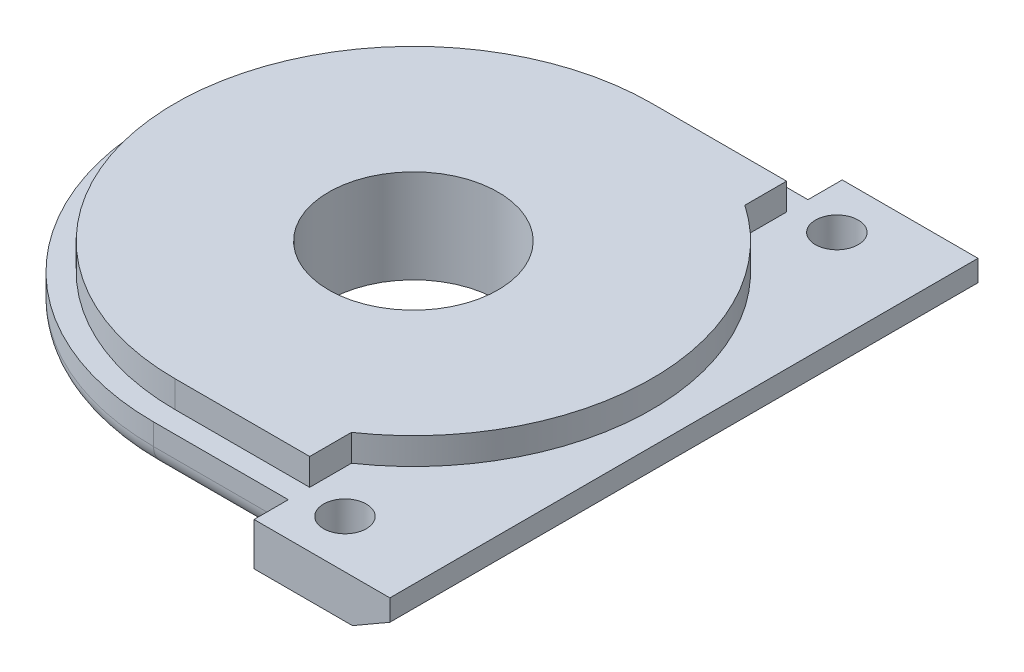
from build123d import *
from build123d.topology import SkipClean

# Parameters (mm, degrees)
BOSS_EXTRUDE1_DEPTH = 4
BOSS_EXTRUDE2_DEPTH = 2.5
SKETCH3_R           = 7.925
CUT_EXTRUDE1_DEPTH  = 9.25
SKETCH4_R           = 2
CUT_EXTRUDE2_DEPTH  = 9.25
CUT_EXTRUDE3_DEPTH  = 3.25
FILLET1_R           = 2.36
CHAMFER1_SIZE       = 3.5
CHAMFER1_SIZE2      = 2.020725942
BOSS_EXTRUDE4_DEPTH = 4
FILLET4_R           = 2
BOSS_EXTRUDE5_START = 2.25
SKETCH11_R          = 11.925
BOSS_EXTRUDE5_DEPTH = 2.25
CUT_EXTRUDE4_START  = -2.25
SKETCH12_R          = 7.925
CUT_EXTRUDE4_DEPTH  = 2.25


with BuildPart() as part:
    # Sketch1 → Boss-Extrude1 (new body)
    with BuildSketch(Plane(origin=(0, 0, 0), x_dir=(1, 0, 0), z_dir=(0, 1, 0))):
        with BuildLine():
            Line((-13.29118379, 20.889836125), (-0.68999579, 20.889836125))
            Line((-0.68999579, 20.889836125), (-0.68999579, 26.09210312))
            Line((-0.68999579, 26.09210312), (12.01000421, 26.09210312))
            Line((12.01000421, 26.09210312), (12.01000421, -28.90789688))
            Line((12.01000421, -28.90789688), (-0.68999579, -28.90789688))
            Line((-0.68999579, -28.90789688), (-0.68999579, -23.705629885))
            Line((-0.68999579, -23.705629885), (-13.29118379, -23.705629885))
            ThreePointArc((-13.29118379, -23.705629885), (-35.588916795, -1.40789688), (-13.29118379, 20.889836125))
        make_face()
    extrude(amount=BOSS_EXTRUDE1_DEPTH)

    # Sketch2 → Boss-Extrude2 (add)
    with BuildSketch(Plane(origin=(0, 4, 0), x_dir=(1, 0, 0), z_dir=(0, 1, 0))):
        with BuildLine():
            Line((-13.29118379, 20.889836125), (-0.68999579, 20.889836125))
            Line((-0.68999579, 20.889836125), (-0.68999579, 16.987726462))
            ThreePointArc((-0.68999579, 16.987726462), (9.006549215, -1.40789688), (-0.68999579, -19.803520222))
            Line((-0.68999579, -19.803520222), (-0.68999579, -23.705629885))
            Line((-0.68999579, -23.705629885), (-13.29118379, -23.705629885))
            ThreePointArc((-13.29118379, -23.705629885), (-35.588916795, -1.40789688), (-13.29118379, 20.889836125))
        make_face()
    extrude(amount=BOSS_EXTRUDE2_DEPTH)

    # Sketch3 → Cut-Extrude1 (cut)
    with BuildSketch(Plane.XZ):
        with Locations(Location((-13.29118379, 1.40789688, 0), (0, 0, 270))):
            Circle(SKETCH3_R)
    extrude(amount=-CUT_EXTRUDE1_DEPTH, mode=Mode.SUBTRACT)

    # Sketch4 → Cut-Extrude2 (cut)
    with BuildSketch(Plane.XZ):
        with Locations(Location((3.31000421, 24.40789688, 0), (0, 0, 270))):
            Circle(SKETCH4_R)
        with Locations(Location((3.310004206, -21.59210312, 0), (0, 0, 270))):
            Circle(SKETCH4_R)
    extrude(amount=-CUT_EXTRUDE2_DEPTH, mode=Mode.SUBTRACT)

    # Sketch5 → Cut-Extrude3 (cut)
    with BuildSketch(Plane.XZ):
        with BuildLine():
            ThreePointArc((-20.901279021, -7.773174712), (-25.21618379, 1.40789688), (-20.901279021, 10.588968471))
            Line((-20.901279021, 10.588968471), (-24.18129969, 16.27013092))
            ThreePointArc((-24.18129969, 16.27013092), (-31.71618379, 1.40789688), (-24.18129969, -13.454337161))
            Line((-24.18129969, -13.454337161), (-20.901279021, -7.773174712))
        make_face()
        with BuildLine():
            Line((-20.717198075, 18.27013092), (-17.437177406, 12.588968471))
            ThreePointArc((-17.437177406, 12.588968471), (-7.32868379, 11.73524982), (-1.535094942, 3.40789688))
            Line((-1.535094942, 3.40789688), (5.024946397, 3.40789688))
            ThreePointArc((5.024946397, 3.40789688), (-4.07868379, 17.364414944), (-20.717198075, 18.27013092))
        make_face()
        with BuildLine():
            ThreePointArc((-1.535094942, -0.59210312), (-7.32868379, -8.91945606), (-17.437177406, -9.773174712))
            Line((-17.437177406, -9.773174712), (-20.717198075, -15.454337161))
            ThreePointArc((-20.717198075, -15.454337161), (-4.07868379, -14.548621185), (5.024946397, -0.59210312))
            Line((5.024946397, -0.59210312), (-1.535094942, -0.59210312))
        make_face()
    extrude(amount=-CUT_EXTRUDE3_DEPTH, mode=Mode.SUBTRACT)

    # Fillet1
    fillet1_edges = [part.edges().sort_by_distance(p)[0] for p in [
        (-20.901279021, 1.625, 10.588968471),
        (-20.901279021, 1.625, -7.773174712),
        (-24.18129969, 1.625, -13.454337161),
        (-24.18129969, 1.625, 16.27013092),
        (5.024946397, 1.625, 3.40789688),
        (-1.535094942, 1.625, 3.40789688),
        (-20.717198075, 1.625, 18.27013092),
        (-1.535094942, 1.625, -0.59210312),
        (5.024946397, 1.625, -0.59210312),
        (-20.717198075, 1.625, -15.454337161),
    ]]
    fillet(fillet1_edges, radius=FILLET1_R)

    # Chamfer1
    chamfer1_edges = [part.edges().sort_by_distance(p)[0] for p in [
        (12.01000421, 0, 1.40789688),
    ]]
    chamfer1_side = [part.faces().sort_by_distance(p)[0] for p in [
        (-3.714999267, 0, 17.994335016),
    ]]
    chamfer(chamfer1_edges, length=CHAMFER1_SIZE, length2=CHAMFER1_SIZE2, reference=chamfer1_side[0])

    # Sketch10 → Boss-Extrude4 (add)
    with BuildSketch(Plane.XZ):
        with BuildLine():
            Line((-0.68999579, -22.889836125), (-13.29118379, -22.889836125))
            ThreePointArc((-13.29118379, -22.889836125), (-37.588916795, 1.40789688), (-13.29118379, 25.705629885))
            Line((-13.29118379, 25.705629885), (-0.68999579, 25.705629885))
            Line((-0.68999579, 25.705629885), (-0.68999579, 23.705629885))
            Line((-0.68999579, 23.705629885), (-13.29118379, 23.705629885))
            ThreePointArc((-13.29118379, 23.705629885), (-35.588916795, 1.40789688), (-13.29118379, -20.889836125))
            Line((-13.29118379, -20.889836125), (-0.68999579, -20.889836125))
            Line((-0.68999579, -20.889836125), (-0.68999579, -22.889836125))
        make_face()
    extrude(amount=-BOSS_EXTRUDE4_DEPTH)

    # Fillet4
    fillet4_edges = [part.edges().sort_by_distance(p)[0] for p in [
        (-6.99058979, 0, 25.705629885),
        (-37.588916795, 0, 1.40789688),
        (-6.99058979, 0, -22.889836125),
    ]]
    fillet(fillet4_edges, radius=FILLET4_R)

    # Sketch11 → Boss-Extrude5 (add)
    with SkipClean():  # the faces are left unmerged after this step: merging them gives an invalid solid
        with BuildSketch(Plane.XZ.offset(BOSS_EXTRUDE5_START)):
            with Locations(Location((-13.29118379, 1.40789688, 0), (0, 0, 270))):
                Circle(SKETCH11_R)
        extrude(amount=-BOSS_EXTRUDE5_DEPTH)

    # Sketch12 → Cut-Extrude4 (cut)
    with SkipClean():  # the faces are left unmerged after this step: merging them gives an invalid solid
        with BuildSketch(Plane(origin=(0, 0, 0), x_dir=(1, 0, 0), z_dir=(0, 1, 0)).offset(CUT_EXTRUDE4_START)):
            with Locations(Location((-13.29118379, -1.40789688, 0), (0, 0, 270))):
                Circle(SKETCH12_R)
        extrude(amount=CUT_EXTRUDE4_DEPTH, mode=Mode.SUBTRACT)


solid = part.part
